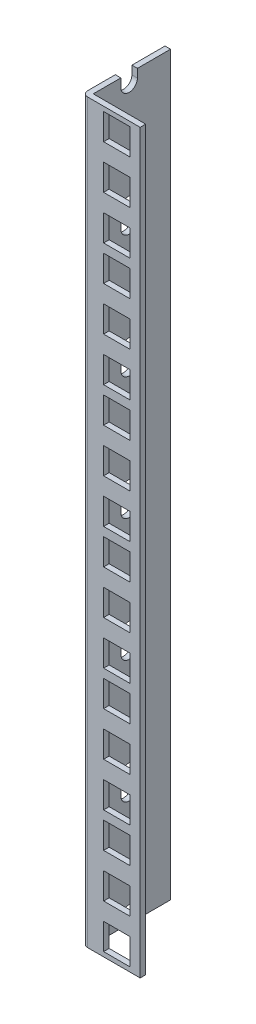
from build123d import *

# Parameters (mm, degrees)
SKETCH1_W           = 30
SKETCH1_H           = 266.8
BOSS_EXTRUDE1_DEPTH = 21
SKETCH2_W           = 19
SKETCH2_H           = 28
CUT_EXTRUDE1_DEPTH  = 270.301392495
CUT_EXTRUDE2_DEPTH  = 270.152819045
CUT_EXTRUDE3_DEPTH  = 270.152819045
CUT_EXTRUDE4_DEPTH  = 270.301392495
CUT_EXTRUDE5_DEPTH  = 270.301392495
CUT_EXTRUDE6_DEPTH  = 270.301392495
CUT_EXTRUDE7_DEPTH  = 270.301392495
SKETCH9_W           = 9.5
SKETCH9_H           = 9.5
CUT_EXTRUDE8_DEPTH  = 270.301392495
SKETCH10_W          = 9.5
SKETCH10_H          = 9.5
CUT_EXTRUDE9_DEPTH  = 270.301392495
SKETCH11_W          = 9.5
SKETCH11_H          = 9.5
CUT_EXTRUDE10_DEPTH = 270.301392495
SKETCH12_W          = 9.5
SKETCH12_H          = 9.5
CUT_EXTRUDE11_DEPTH = 270.301392495
SKETCH13_W          = 9.5
SKETCH13_H          = 9.5
CUT_EXTRUDE12_DEPTH = 270.301392495
SKETCH14_W          = 9.5
SKETCH14_H          = 9.5
CUT_EXTRUDE13_DEPTH = 270.301392495
SKETCH15_W          = 9.5
SKETCH15_H          = 9.5
CUT_EXTRUDE14_DEPTH = 270.301392495
SKETCH16_W          = 9.5
SKETCH16_H          = 9.5
CUT_EXTRUDE15_DEPTH = 270.301392495
SKETCH17_W          = 9.5
SKETCH17_H          = 9.5
CUT_EXTRUDE16_DEPTH = 270.301392495
SKETCH18_W          = 9.5
SKETCH18_H          = 9.5
CUT_EXTRUDE17_DEPTH = 270.301392495
SKETCH19_W          = 9.5
SKETCH19_H          = 9.5
CUT_EXTRUDE18_DEPTH = 270.301392495
SKETCH20_W          = 9.5
SKETCH20_H          = 9.5
CUT_EXTRUDE19_DEPTH = 270.301392495
SKETCH21_W          = 9.5
SKETCH21_H          = 9.5
CUT_EXTRUDE20_DEPTH = 270.301392495
SKETCH22_W          = 9.5
SKETCH22_H          = 9.5
CUT_EXTRUDE21_DEPTH = 270.301392495
SKETCH23_W          = 9.5
SKETCH23_H          = 9.5
CUT_EXTRUDE22_DEPTH = 270.301392495
SKETCH24_W          = 9.5
SKETCH24_H          = 9.5
CUT_EXTRUDE23_DEPTH = 270.301392495
SKETCH25_W          = 9.5
SKETCH25_H          = 9.5
CUT_EXTRUDE24_DEPTH = 270.301392495
SKETCH26_W          = 9.5
SKETCH26_H          = 9.5
CUT_EXTRUDE25_DEPTH = 270.301392495
CUT_EXTRUDE26_DEPTH = 270.152819045
FILLET1_R           = 0.005
FILLET2_R           = 2.005


with BuildPart() as part:
    # Sketch1 → Boss-Extrude1 (new body)
    with BuildSketch(Plane(origin=(0, 0, 0), x_dir=(0, 0, -1), z_dir=(1, 0, 0))):
        with Locations((15, 133.4)):
            Rectangle(SKETCH1_W, SKETCH1_H)
    extrude(amount=-BOSS_EXTRUDE1_DEPTH)

    # Sketch2 → Cut-Extrude1 (cut, through all)
    with BuildSketch(Plane(origin=(0, 266.8, 0), x_dir=(-1, 0, 0), z_dir=(0, 1, 0))):
        with Locations((9.5, -16)):
            Rectangle(SKETCH2_W, SKETCH2_H)
    extrude(amount=-CUT_EXTRUDE1_DEPTH, mode=Mode.SUBTRACT)

    # Sketch3 → Cut-Extrude2 (cut, through all)
    with BuildSketch(Plane(origin=(-19, 0, 0), x_dir=(0, 0, -1), z_dir=(1, 0, 0))):
        with BuildLine():
            Line((12, 266.8), (12, 263.75))
            ThreePointArc((12, 263.75), (15, 260.75), (18, 263.75))
            Line((18, 263.75), (18, 266.8))
            Line((18, 266.8), (12, 266.8))
        make_face()
    extrude(amount=-CUT_EXTRUDE2_DEPTH, mode=Mode.SUBTRACT)

    # Sketch4 → Cut-Extrude3 (cut, through all)
    with BuildSketch(Plane(origin=(-19, 0, 0), x_dir=(0, 0, -1), z_dir=(1, 0, 0))):
        with BuildLine():
            Line((18, 0), (18, 3.05))
            ThreePointArc((18, 3.05), (15, 6.05), (12, 3.05))
            Line((12, 3.05), (12, 0))
            Line((12, 0), (18, 0))
        make_face()
    extrude(amount=-CUT_EXTRUDE3_DEPTH, mode=Mode.SUBTRACT)

    # Sketch5 → Cut-Extrude4 (cut, through all)
    with BuildSketch(Plane.ZY.offset(21)):
        with BuildLine():
            Line((-12, 41.5), (-12, 47.5))
            ThreePointArc((-12, 47.5), (-15, 50.5), (-18, 47.5))
            Line((-18, 47.5), (-18, 41.5))
            ThreePointArc((-18, 41.5), (-15, 38.5), (-12, 41.5))
        make_face()
    extrude(amount=-CUT_EXTRUDE4_DEPTH, mode=Mode.SUBTRACT)

    # Sketch6 → Cut-Extrude5 (cut, through all)
    with BuildSketch(Plane.ZY.offset(21)):
        with BuildLine():
            Line((-12, 85.95), (-12, 91.95))
            ThreePointArc((-12, 91.95), (-15, 94.95), (-18, 91.95))
            Line((-18, 91.95), (-18, 85.95))
            ThreePointArc((-18, 85.95), (-15, 82.95), (-12, 85.95))
        make_face()
    extrude(amount=-CUT_EXTRUDE5_DEPTH, mode=Mode.SUBTRACT)

    # Sketch7 → Cut-Extrude6 (cut, through all)
    with BuildSketch(Plane.ZY.offset(21)):
        with BuildLine():
            Line((-12, 130.4), (-12, 136.4))
            ThreePointArc((-12, 136.4), (-15, 139.4), (-18, 136.4))
            Line((-18, 136.4), (-18, 130.4))
            ThreePointArc((-18, 130.4), (-15, 127.4), (-12, 130.4))
        make_face()
    extrude(amount=-CUT_EXTRUDE6_DEPTH, mode=Mode.SUBTRACT)

    # Sketch8 → Cut-Extrude7 (cut, through all)
    with BuildSketch(Plane.ZY.offset(21)):
        with BuildLine():
            Line((-12, 174.85), (-12, 180.85))
            ThreePointArc((-12, 180.85), (-15, 183.85), (-18, 180.85))
            Line((-18, 180.85), (-18, 174.85))
            ThreePointArc((-18, 174.85), (-15, 171.85), (-12, 174.85))
        make_face()
    extrude(amount=-CUT_EXTRUDE7_DEPTH, mode=Mode.SUBTRACT)

    # Sketch9 → Cut-Extrude8 (cut, through all)
    with BuildSketch(Plane.XY):
        with Locations((-8.5, 244.525)):
            Rectangle(SKETCH9_W, SKETCH9_H)
    extrude(amount=-CUT_EXTRUDE8_DEPTH, mode=Mode.SUBTRACT)

    # Sketch10 → Cut-Extrude9 (cut, through all)
    with BuildSketch(Plane.XY):
        with Locations((-8.5, 228.65)):
            Rectangle(SKETCH10_W, SKETCH10_H)
    extrude(amount=-CUT_EXTRUDE9_DEPTH, mode=Mode.SUBTRACT)

    # Sketch11 → Cut-Extrude10 (cut, through all)
    with BuildSketch(Plane.XY):
        with Locations((-8.5, 215.95)):
            Rectangle(SKETCH11_W, SKETCH11_H)
    extrude(amount=-CUT_EXTRUDE10_DEPTH, mode=Mode.SUBTRACT)

    # Sketch12 → Cut-Extrude11 (cut, through all)
    with BuildSketch(Plane.XY):
        with Locations((-8.5, 200.075)):
            Rectangle(SKETCH12_W, SKETCH12_H)
    extrude(amount=-CUT_EXTRUDE11_DEPTH, mode=Mode.SUBTRACT)

    # Sketch13 → Cut-Extrude12 (cut, through all)
    with BuildSketch(Plane.XY):
        with Locations((-8.5, 184.2)):
            Rectangle(SKETCH13_W, SKETCH13_H)
    extrude(amount=-CUT_EXTRUDE12_DEPTH, mode=Mode.SUBTRACT)

    # Sketch14 → Cut-Extrude13 (cut, through all)
    with BuildSketch(Plane.XY):
        with Locations((-8.5, 171.5)):
            Rectangle(SKETCH14_W, SKETCH14_H)
    extrude(amount=-CUT_EXTRUDE13_DEPTH, mode=Mode.SUBTRACT)

    # Sketch15 → Cut-Extrude14 (cut, through all)
    with BuildSketch(Plane.XY):
        with Locations((-8.5, 155.625)):
            Rectangle(SKETCH15_W, SKETCH15_H)
    extrude(amount=-CUT_EXTRUDE14_DEPTH, mode=Mode.SUBTRACT)

    # Sketch16 → Cut-Extrude15 (cut, through all)
    with BuildSketch(Plane.XY):
        with Locations((-8.5, 139.75)):
            Rectangle(SKETCH16_W, SKETCH16_H)
    extrude(amount=-CUT_EXTRUDE15_DEPTH, mode=Mode.SUBTRACT)

    # Sketch17 → Cut-Extrude16 (cut, through all)
    with BuildSketch(Plane.XY):
        with Locations((-8.5, 127.05)):
            Rectangle(SKETCH17_W, SKETCH17_H)
    extrude(amount=-CUT_EXTRUDE16_DEPTH, mode=Mode.SUBTRACT)

    # Sketch18 → Cut-Extrude17 (cut, through all)
    with BuildSketch(Plane.XY):
        with Locations((-8.5, 111.175)):
            Rectangle(SKETCH18_W, SKETCH18_H)
    extrude(amount=-CUT_EXTRUDE17_DEPTH, mode=Mode.SUBTRACT)

    # Sketch19 → Cut-Extrude18 (cut, through all)
    with BuildSketch(Plane.XY):
        with Locations((-8.5, 95.3)):
            Rectangle(SKETCH19_W, SKETCH19_H)
    extrude(amount=-CUT_EXTRUDE18_DEPTH, mode=Mode.SUBTRACT)

    # Sketch20 → Cut-Extrude19 (cut, through all)
    with BuildSketch(Plane.XY):
        with Locations((-8.5, 82.6)):
            Rectangle(SKETCH20_W, SKETCH20_H)
    extrude(amount=-CUT_EXTRUDE19_DEPTH, mode=Mode.SUBTRACT)

    # Sketch21 → Cut-Extrude20 (cut, through all)
    with BuildSketch(Plane.XY):
        with Locations((-8.5, 66.725)):
            Rectangle(SKETCH21_W, SKETCH21_H)
    extrude(amount=-CUT_EXTRUDE20_DEPTH, mode=Mode.SUBTRACT)

    # Sketch22 → Cut-Extrude21 (cut, through all)
    with BuildSketch(Plane.XY):
        with Locations((-8.5, 50.85)):
            Rectangle(SKETCH22_W, SKETCH22_H)
    extrude(amount=-CUT_EXTRUDE21_DEPTH, mode=Mode.SUBTRACT)

    # Sketch23 → Cut-Extrude22 (cut, through all)
    with BuildSketch(Plane.XY):
        with Locations((-8.5, 38.15)):
            Rectangle(SKETCH23_W, SKETCH23_H)
    extrude(amount=-CUT_EXTRUDE22_DEPTH, mode=Mode.SUBTRACT)

    # Sketch24 → Cut-Extrude23 (cut, through all)
    with BuildSketch(Plane.XY):
        with Locations((-8.5, 22.275)):
            Rectangle(SKETCH24_W, SKETCH24_H)
    extrude(amount=-CUT_EXTRUDE23_DEPTH, mode=Mode.SUBTRACT)

    # Sketch25 → Cut-Extrude24 (cut, through all)
    with BuildSketch(Plane.XY):
        with Locations((-8.5, 6.4)):
            Rectangle(SKETCH25_W, SKETCH25_H)
    extrude(amount=-CUT_EXTRUDE24_DEPTH, mode=Mode.SUBTRACT)

    # Sketch26 → Cut-Extrude25 (cut, through all)
    with BuildSketch(Plane.XY):
        with Locations((-8.5, 260.4)):
            Rectangle(SKETCH26_W, SKETCH26_H)
    extrude(amount=-CUT_EXTRUDE25_DEPTH, mode=Mode.SUBTRACT)

    # Sketch27 → Cut-Extrude26 (cut, through all)
    with BuildSketch(Plane(origin=(-19, 0, 0), x_dir=(0, 0, -1), z_dir=(1, 0, 0))):
        with BuildLine():
            Line((12, 225.3), (12, 219.3))
            ThreePointArc((12, 219.3), (15, 216.3), (18, 219.3))
            Line((18, 219.3), (18, 225.3))
            ThreePointArc((18, 225.3), (15, 228.3), (12, 225.3))
        make_face()
    extrude(amount=-CUT_EXTRUDE26_DEPTH, mode=Mode.SUBTRACT)

    # Fillet1
    fillet1_edges = [part.edges().sort_by_distance(p)[0] for p in [
        (-19, 133.4, -2),
    ]]
    fillet(fillet1_edges, radius=FILLET1_R)

    # Fillet2
    fillet2_edges = [part.edges().sort_by_distance(p)[0] for p in [
        (-21, 133.4, 0),
    ]]
    fillet(fillet2_edges, radius=FILLET2_R)


solid = part.part
